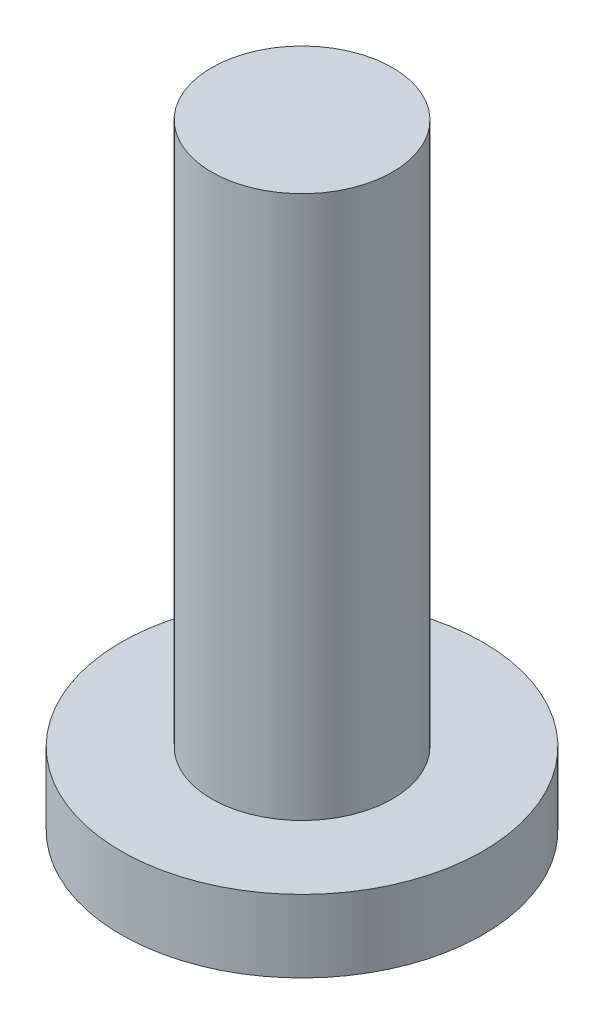
from build123d import *

# Parameters (mm, degrees)
ESBO_O1_R                = 12.5
RESSALTO_EXTRUS_O1_DEPTH = 75
ESBO_O2_R                = 25
RESSALTO_EXTRUS_O2_DEPTH = 10


with BuildPart() as part:
    # Esboço1 → Ressalto-extrusão1 (new body)
    with BuildSketch(Plane(origin=(0, 0, 0), x_dir=(1, 0, 0), z_dir=(0, 1, 0))):
        with Locations(Location((0, 0, 0), (0, 0, 270))):
            Circle(ESBO_O1_R)
    extrude(amount=RESSALTO_EXTRUS_O1_DEPTH)

    # Esboço2 → Ressalto-extrusão2 (add)
    with BuildSketch(Plane.XZ):
        with Locations(Location((0, 0, 0), (0, 0, 270))):
            Circle(ESBO_O2_R)
    extrude(amount=RESSALTO_EXTRUS_O2_DEPTH)


solid = part.part
